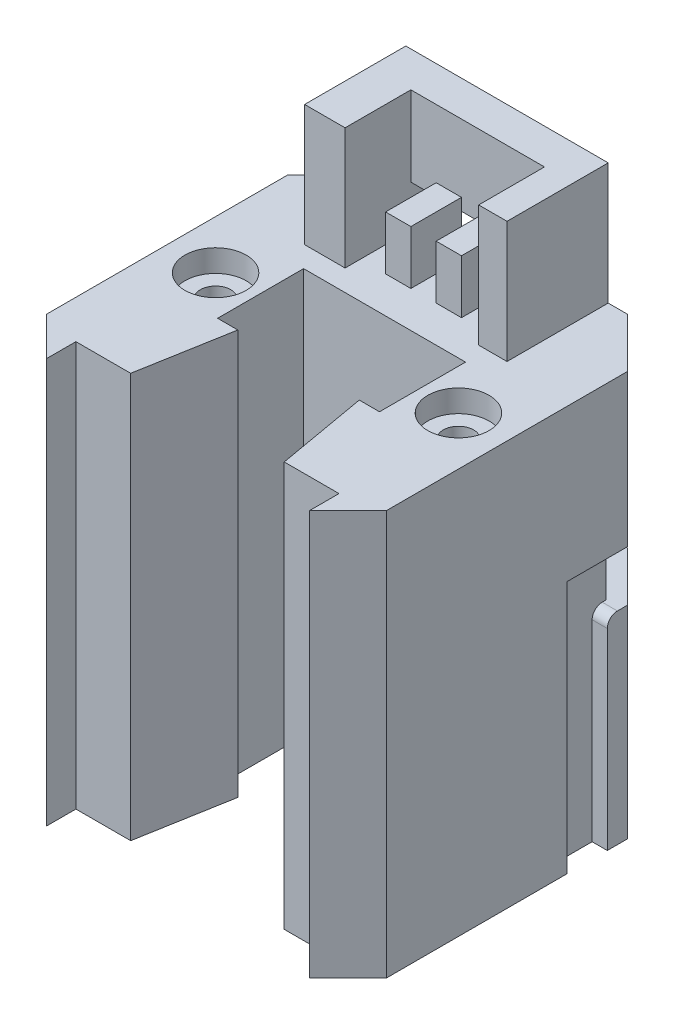
from build123d import *

# Parameters (mm, degrees)
EXTRUDE_1_DEPTH      = 40
SKETCH_2_R           = 1.5
CUT_EXTRUDE_1_DEPTH  = 47.523972315
CUT_EXTRUDE_2_DEPTH  = 47.523972315
EXTRUDE_2_DEPTH      = 12
SKETCH_5_W           = 12
SKETCH_5_H           = 8.5
CUT_EXTRUDE_3_DEPTH  = 47.523972315
CUT_EXTRUDE_4_DEPTH  = 12
SKETCH_7_W           = 2.5
SKETCH_7_H           = 5
EXTRUDE_3_DEPTH      = 5.3
SKETCH_8_W           = 2.5
SKETCH_8_H           = 5
EXTRUDE_4_DEPTH      = 5.2
SKETCH_10_W          = 16
SKETCH_10_H          = 8.5
CUT_EXTRUDE_5_DEPTH  = 47.523972315
SKETCH_11_W          = 7.5
SKETCH_11_H          = 4.1
CUT_EXTRUDE_6_DEPTH  = 11
SKETCH_15_W          = 7.5
SKETCH_15_H          = 5
CUT_EXTRUDE_10_DEPTH = 10
SKETCH_12_W          = 7.5
SKETCH_12_H          = 1.5
CUT_EXTRUDE_7_DEPTH  = 28
CUT_EXTRUDE_START    = -20
CUT_EXTRUDE_8_DEPTH  = 5
FILLET_2_R           = 2
SKETCH_16_R          = 3.025
CUT_EXTRUDE_11_DEPTH = 2.2
SKETCH_17_W          = 1.5
SKETCH_17_H          = 4
CUT_EXTRUDE_12_DEPTH = 40.855739863
FILLET_3_R           = 1


with BuildPart() as part:
    # 草图1 → 凸台-拉伸1 (new body)
    with BuildSketch(Plane(origin=(0, 0, 0), x_dir=(1, 0, 0), z_dir=(0, 1, 0))):
        Polygon((11.908535316, 16.8), (-11.908535316, 16.8), (-16.8, 11.908535316), (-16.8, -11.908535316), (-11.908535316, -16.8), (11.908535316, -16.8), (16.8, -11.908535316), (16.8, 11.908535316), align=None)
    extrude(amount=EXTRUDE_1_DEPTH)

    # 草图2 → 切除-拉伸1 (cut, through all)
    with BuildSketch(Plane(origin=(0, 40, 0), x_dir=(1, 0, 0), z_dir=(0, 1, 0))):
        with Locations(Location((12, 0, 0), (0, 0, 270))):
            Circle(SKETCH_2_R)
        with Locations(Location((-12, 0, 0), (0, 0, 90))):
            Circle(SKETCH_2_R)
    extrude(amount=-CUT_EXTRUDE_1_DEPTH, mode=Mode.SUBTRACT)

    # 草图3 → 切除-拉伸2 (cut, through all)
    with BuildSketch(Plane(origin=(0, 40, 0), x_dir=(1, 0, 0), z_dir=(0, 1, 0))):
        Polygon((-6, -3.8), (6, -3.8), (7.586942826, -12.8), (13, -12.8), (13, -16.8), (-13, -16.8), (-13, -12.8), (-7.586942826, -12.8), align=None)
    extrude(amount=-CUT_EXTRUDE_2_DEPTH, mode=Mode.SUBTRACT)

    # 草图4 → 凸台-拉伸2 (add)
    with BuildSketch(Plane(origin=(0, 40, 0), x_dir=(1, 0, 0), z_dir=(0, 1, 0))):
        Polygon((-10, 16.8), (-10, 6.8), (-6, 6.8), (-6, 13.3), (7.2, 13.3), (7.2, 6.8), (10, 6.8), (10, 16.8), align=None)
    extrude(amount=EXTRUDE_2_DEPTH)

    # 草图5 → 切除-拉伸3 (cut, through all)
    with BuildSketch(Plane(origin=(0, 40, 0), x_dir=(1, 0, 0), z_dir=(0, 1, 0))):
        with Locations((0, 0.45)):
            Rectangle(SKETCH_5_W, SKETCH_5_H)
    extrude(amount=-CUT_EXTRUDE_3_DEPTH, mode=Mode.SUBTRACT)

    # 草图6 → 切除-拉伸4 (cut)
    with BuildSketch(Plane.XZ):
        Polygon((-6, -6.8), (-6, -13.3), (-6, -16.8), (7.2, -16.8), (7.2, -13.3), (7.2, -6.8), align=None)
    extrude(amount=-CUT_EXTRUDE_4_DEPTH, mode=Mode.SUBTRACT)

    # 草图7 → 凸台-拉伸3 (add)
    with BuildSketch(Plane(origin=(0, 40, 0), x_dir=(1, 0, 0), z_dir=(0, 1, 0))):
        with Locations((2.75, 10.8)):
            Rectangle(SKETCH_7_W, SKETCH_7_H)
        with Locations((-2.25, 10.8)):
            Rectangle(SKETCH_7_W, SKETCH_7_H)
    extrude(amount=EXTRUDE_3_DEPTH)

    # 草图8 → 凸台-拉伸4 (add)
    with BuildSketch(Plane.XZ.offset(-12)):
        with Locations((-2.25, -9.3)):
            Rectangle(SKETCH_8_W, SKETCH_8_H)
        with Locations((2.75, -9.3)):
            Rectangle(SKETCH_8_W, SKETCH_8_H)
    extrude(amount=EXTRUDE_4_DEPTH)

    # 草图10 → 切除-拉伸5 (cut, through all)
    with BuildSketch(Plane(origin=(0, 40, 0), x_dir=(1, 0, 0), z_dir=(0, 1, 0))):
        with Locations((0, 0.45)):
            Rectangle(SKETCH_10_W, SKETCH_10_H)
    extrude(amount=-CUT_EXTRUDE_5_DEPTH, mode=Mode.SUBTRACT)

    # 草图11 → 切除-拉伸6 (cut)
    with BuildSketch(Plane.XY.offset(-13.3)):
        with Locations((-2.25, 42.05)):
            Rectangle(SKETCH_11_W, SKETCH_11_H)
    extrude(amount=-CUT_EXTRUDE_6_DEPTH, mode=Mode.SUBTRACT)

    # 草图15 → 切除-拉伸10 (cut)
    with BuildSketch(Plane(origin=(0, 0, -16.8), x_dir=(-1, 0, 0), z_dir=(0, 0, -1))):
        with Locations((2.25, 14.5)):
            Rectangle(SKETCH_15_W, SKETCH_15_H)
    extrude(amount=-CUT_EXTRUDE_10_DEPTH, mode=Mode.SUBTRACT)

    # 草图12 → 切除-拉伸7 (cut)
    with BuildSketch(Plane(origin=(0, 40, 0), x_dir=(1, 0, 0), z_dir=(0, 1, 0))):
        with Locations((-2.25, 16.05)):
            Rectangle(SKETCH_12_W, SKETCH_12_H)
    extrude(amount=-CUT_EXTRUDE_7_DEPTH, mode=Mode.SUBTRACT)

    # 草图13 → 切除-拉伸8 (cut)
    with BuildSketch(Plane.XZ.offset(CUT_EXTRUDE_START)):
        Polygon((11.908535316, -16.8), (1.5, -16.8), (1.5, -15.3), (11.287214973, -15.3), (15.3, -11.287214973), (15.3, -5.908535316), (16.8, -5.908535316), (16.8, -11.908535316), align=None)
    extrude(amount=-CUT_EXTRUDE_8_DEPTH, mode=Mode.SUBTRACT)

    # 圆角2
    fillet_2_edges = [part.edges().sort_by_distance(p)[0] for p in [
        (-2.25, 17, -15.3),
    ]]
    fillet(fillet_2_edges, radius=FILLET_2_R)

    # 草图16 → 切除-拉伸11 (cut)
    with BuildSketch(Plane(origin=(0, 40, 0), x_dir=(1, 0, 0), z_dir=(0, 1, 0))):
        with Locations(Location((12, 0, 0), (0, 0, 270))):
            Circle(SKETCH_16_R)
        with Locations(Location((-12, 0, 0), (0, 0, 270))):
            Circle(SKETCH_16_R)
    cut_extrude_11 = extrude(amount=-CUT_EXTRUDE_11_DEPTH, mode=Mode.SUBTRACT)

    # 镜向1: 切除-拉伸11 across plane
    add(cut_extrude_11.mirror(Plane.ZX.offset(20)), mode=Mode.SUBTRACT)

    # 草图17 → 切除-拉伸12 (cut, through all)
    with BuildSketch(Plane(origin=(0, 20, 0), x_dir=(1, 0, 0), z_dir=(0, 1, 0))):
        with Locations((16.05, 7.908535316)):
            Rectangle(SKETCH_17_W, SKETCH_17_H)
    extrude(amount=-CUT_EXTRUDE_12_DEPTH, mode=Mode.SUBTRACT)

    # 圆角3
    fillet_3_edges = [part.edges().sort_by_distance(p)[0] for p in [
        (1.5, 25, -16.05),
        (1.5, 20, -16.05),
        (16.05, 20, -9.908535316),
    ]]
    fillet(fillet_3_edges, radius=FILLET_3_R)


solid = part.part
